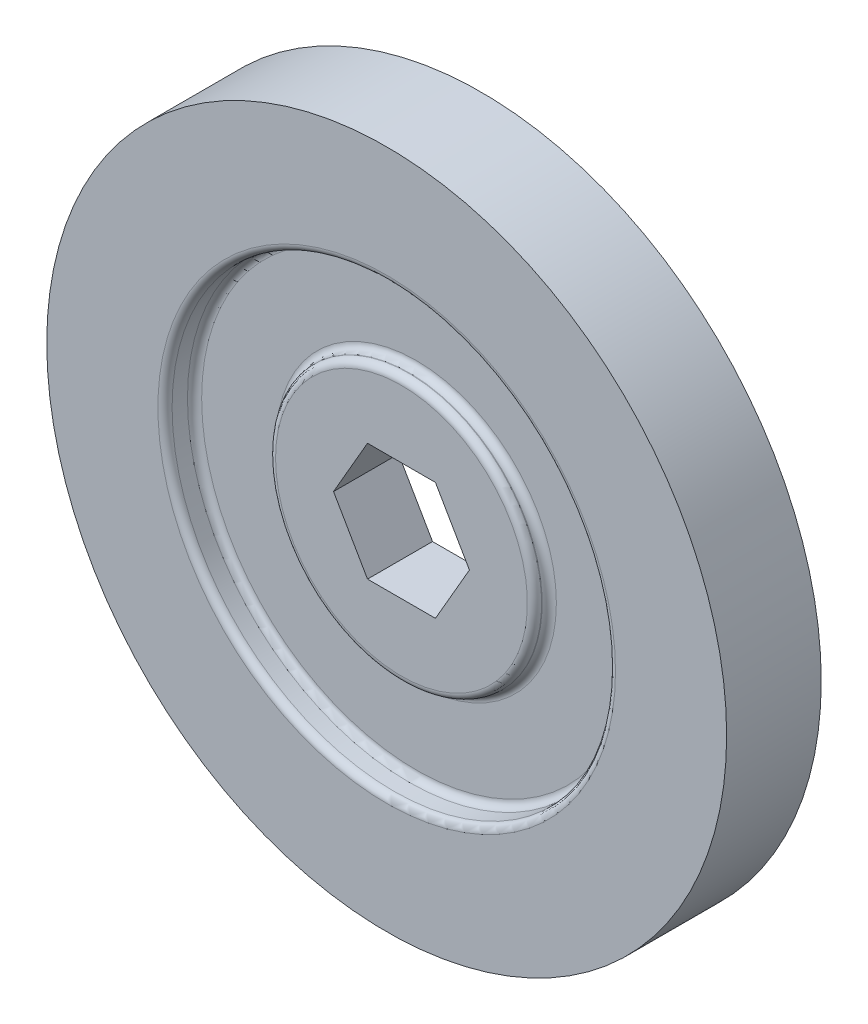
from build123d import *

# Parameters (mm, degrees)
BOSS_EXTRUDE1_DEPTH      = 5.08
BOSS_EXTRUDE1_DEPTH_BACK = 5.08
SKETCH1_R                = 36.5125
CUT_EXTRUDE1_DEPTH       = 53.6265229
FILLET1_R                = 0.762
FILLET2_R                = 0.762


with BuildPart() as part:
    # Sketch1 → Boss-Extrude1 (new, two sides: drawn at the far end of the back side and taken through both)
    with BuildSketch(Plane.XY.offset(-BOSS_EXTRUDE1_DEPTH_BACK)):
        Circle(SKETCH1_R)
    extrude(amount=BOSS_EXTRUDE1_DEPTH + BOSS_EXTRUDE1_DEPTH_BACK)

    # Sketch2 → Cut-Extrude1 (cut, through all)
    with BuildSketch(Plane.XY.offset(5.08)):
        Polygon((3.648853701, 6.32), (-3.648853701, 6.32), (-7.297707403, 0), (-3.648853701, -6.32), (3.648853701, -6.32), (7.297707403, 0), align=None)
    extrude(amount=-CUT_EXTRUDE1_DEPTH, mode=Mode.SUBTRACT)

    # Sketch3 → Cut-Revolve1 (revolve, cut)
    with BuildSketch(Plane(origin=(0, 0, 0), x_dir=(0, 0, -1), z_dir=(1, 0, 0))):
        Polygon((3.4925, 14.2875), (1.905, 14.2875), (1.905, 23.8125), (5.08, 23.8125), (5.08, 0), (3.4925, 0), align=None)
    cut_revolve1 = revolve(axis=Axis((0, 0, -22.753035396), (0, 0, 1)), mode=Mode.SUBTRACT)

    # Fillet1
    fillet1_edges = [part.edges().sort_by_distance(p)[0] for p in [
        (0, -14.2875, -1.905),
        (0, -23.8125, -5.08),
        (0, -14.2875, -3.4925),
    ]]
    fillet(fillet1_edges, radius=FILLET1_R)

    # Mirror1: Cut-Revolve1 across plane
    add(cut_revolve1.mirror(Plane.XY), mode=Mode.SUBTRACT)

    # Fillet2
    fillet2_edges = [part.edges().sort_by_distance(p)[0] for p in [
        (0, -23.8125, 5.08),
        (0, -23.8125, 1.905),
        (0, -14.2875, 1.905),
        (0, -14.2875, 3.4925),
    ]]
    fillet(fillet2_edges, radius=FILLET2_R)


solid = part.part
